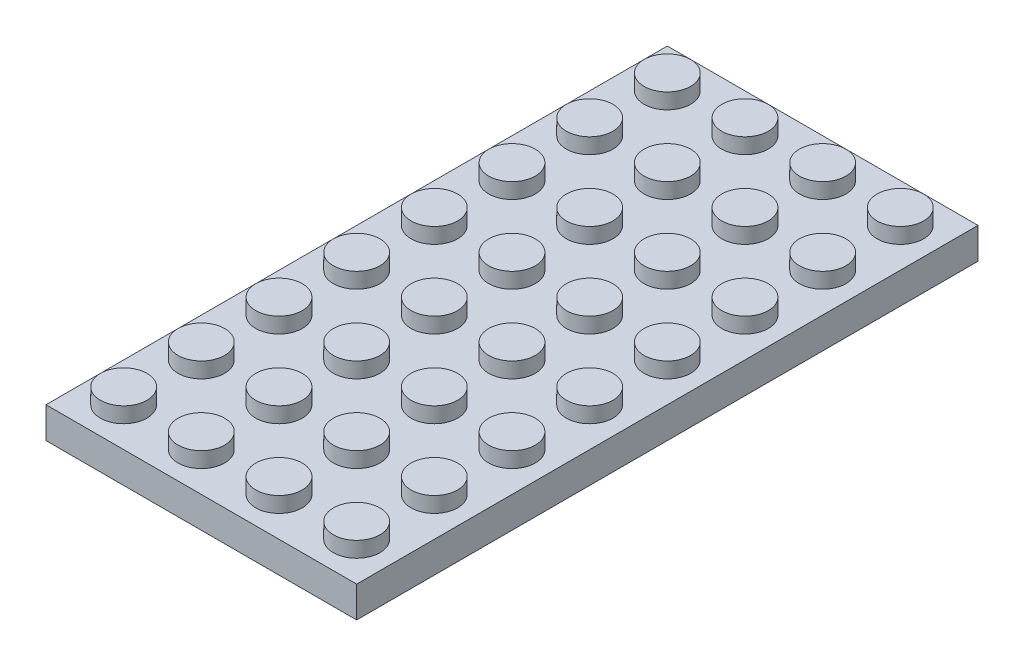
from build123d import *

# Parameters (mm, degrees)
SKETCH1_W            = 32
SKETCH1_H            = 64
BOSS_EXTRUDE1_DEPTH  = 3.2
SKETCH2_R            = 2.4
BOSS_EXTRUDE2_DEPTH  = 1.6
LPATTERN1_COUNT      = 4
LPATTERN1_PITCH      = 8
LPATTERN1_COUNT_DIR2 = 8
LPATTERN1_PITCH_DIR2 = 8
SHELL1_T             = -1.6


with BuildPart() as part:
    # Sketch1 → Boss-Extrude1 (new body)
    with BuildSketch(Plane(origin=(0, 0, 0), x_dir=(1, 0, 0), z_dir=(0, 1, 0))):
        with Locations((16, 32)):
            Rectangle(SKETCH1_W, SKETCH1_H)
    extrude(amount=BOSS_EXTRUDE1_DEPTH)

    # Sketch2 → Boss-Extrude2 (add)
    with BuildSketch(Plane(origin=(0, 3.2, 0), x_dir=(1, 0, 0), z_dir=(0, 1, 0))):
        with Locations(Location((28, 4, 0), (0, 0, 90))):
            Circle(SKETCH2_R)
    boss_extrude2 = extrude(amount=BOSS_EXTRUDE2_DEPTH)

    # LPattern1: Boss-Extrude2 4 × 8
    with Locations(*[(-i * LPATTERN1_PITCH, 0, -j * LPATTERN1_PITCH_DIR2) for i in range(LPATTERN1_COUNT) for j in range(LPATTERN1_COUNT_DIR2) if (i, j) != (0, 0)]):
        add(boss_extrude2)

    # Shell1
    shell1_openings = [part.faces().sort_by_distance(p)[0] for p in [
        (16, 0, -32),
    ]]
    offset(amount=SHELL1_T, openings=shell1_openings, kind=Kind.INTERSECTION)


solid = part.part
